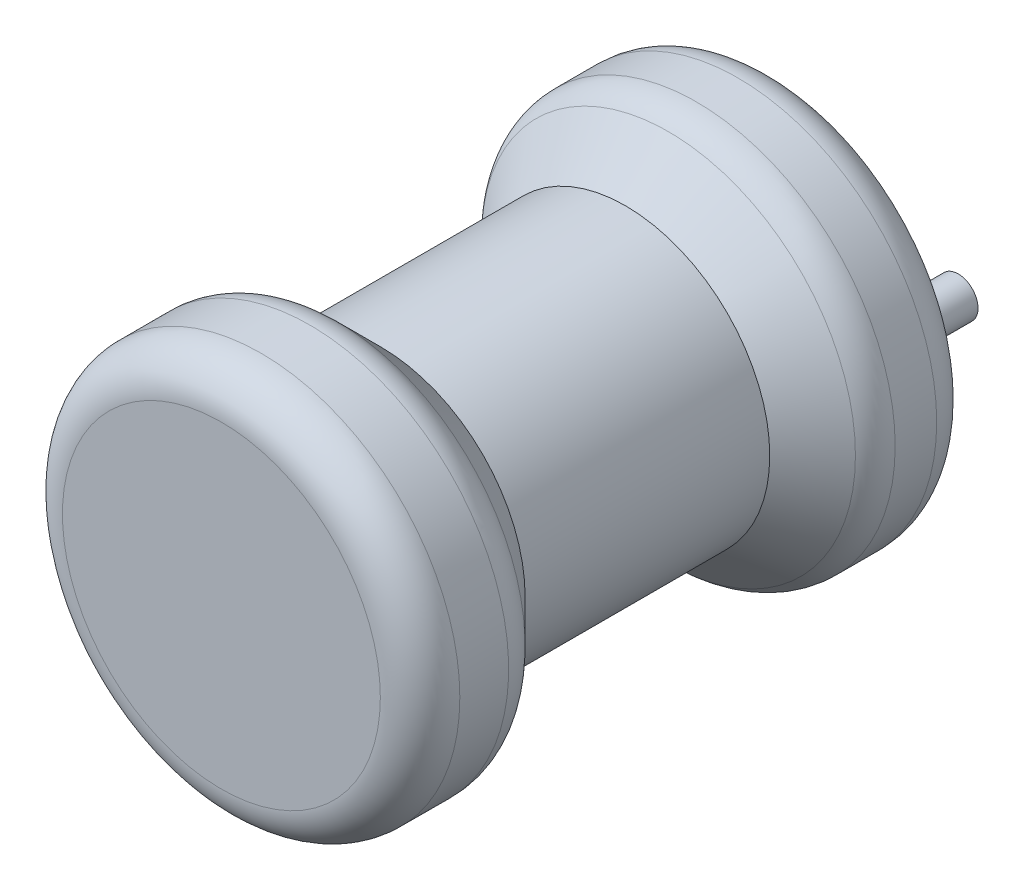
from build123d import *

# Parameters (mm, degrees)
SKETCH_1_R      = 5
EXTRUDE_1_DEPTH = 14
SKETCH_4_R      = 0.5
EXTRUDE_2_DEPTH = 2
FILLET_2_R      = 1


with BuildPart() as part:
    # 草图1 → 凸台-拉伸1 (new body)
    with BuildSketch(Plane.XY):
        Circle(SKETCH_1_R)
    extrude(amount=EXTRUDE_1_DEPTH)

    # 草图3 → 切除-旋转1 (revolve, cut)
    with BuildSketch(Plane(origin=(0, 0, 0), x_dir=(1, 0, 0), z_dir=(0, 1, 0))):
        Polygon((-5.273110547, -2.186263047), (-3.629051397, -3.830322197), (-3.629051397, -9.985928365), (-5.273110547, -11.629987515), align=None)
    revolve(axis=Axis((0, 0, -0.7), (0, 0, 1)), mode=Mode.SUBTRACT)

    # 草图4 → 凸台-拉伸2 (add)
    with BuildSketch(Plane.XY):
        with Locations((-2.54, 0)):
            Circle(SKETCH_4_R)
        with Locations(Location((2.54, 0, 0), (0, 0, 180))):
            Circle(SKETCH_4_R)
    extrude(amount=-EXTRUDE_2_DEPTH)

    # 圆角2
    fillet_2_edges = [part.edges().sort_by_distance(p)[0] for p in [
        (-5, 0, 0),
        (-5, 0, 14),
        (0, -5, 2.459373595),
        (0, -5, 11.356876968),
    ]]
    fillet(fillet_2_edges, radius=FILLET_2_R)


solid = part.part
